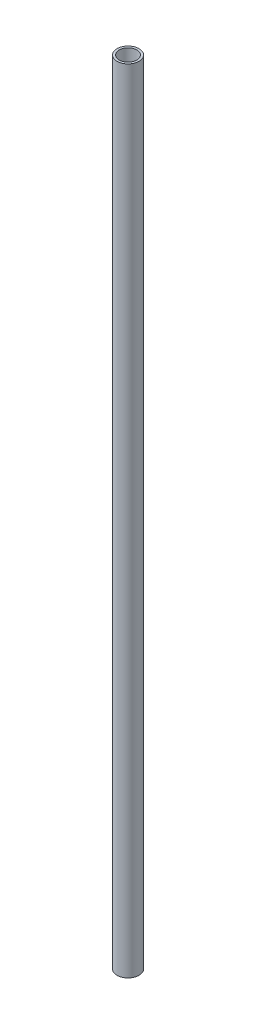
from build123d import *

# Parameters (mm, degrees)
ESBO_O1_R                = 2.5
ESBO_O1_R_2              = 2
RESSALTO_EXTRUS_O1_DEPTH = 180


with BuildPart() as part:
    # Esboço1 → Ressalto-extrusão1 (new body)
    with BuildSketch(Plane(origin=(0, 0, 0), x_dir=(1, 0, 0), z_dir=(0, 1, 0))):
        with Locations(Location((33.085195742, 40.358987491, 0), (0, 0, 90))):
            Circle(ESBO_O1_R)
        with Locations(Location((33.085195742, 40.358987491, 0), (0, 0, 90))):
            Circle(ESBO_O1_R_2, mode=Mode.SUBTRACT)
    extrude(amount=RESSALTO_EXTRUS_O1_DEPTH)


solid = part.part
